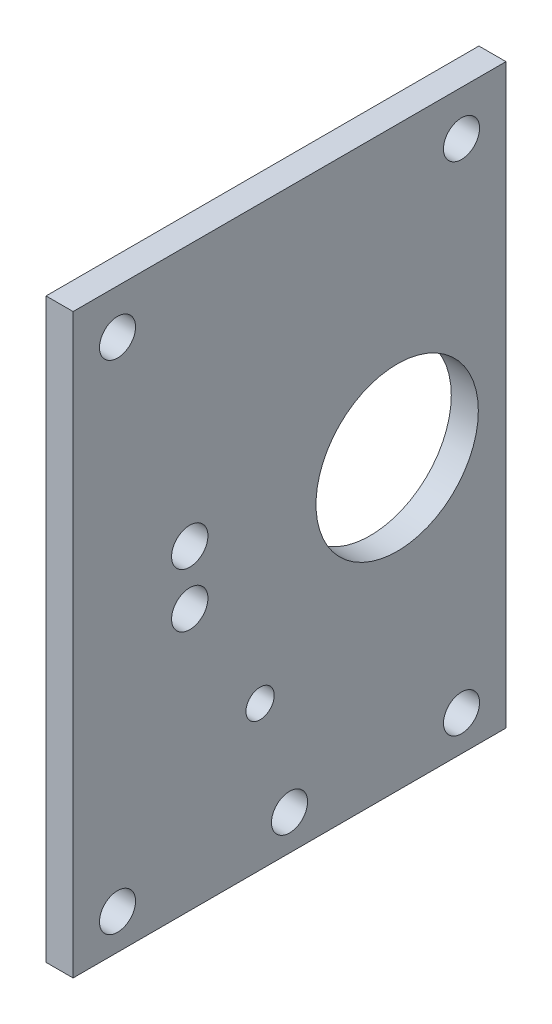
from build123d import *

# Parameters (mm, degrees)
SKETCH2_W            = 76.2
SKETCH2_H            = 101.6
BOSS_EXTRUDE1_DEPTH  = 4.7625
SKETCH3_R            = 3.175
CUT_EXTRUDE1_DEPTH   = 6.35
SKETCH3_4_R          = 3.175
SKETCH3_4_R_2        = 14.2875
SKETCH3_4_R_3        = 2.4892
CUT_EXTRUDE2_DEPTH   = 6.35
M6_CLEARANCE_HOLE1_D = 6.4


with BuildPart() as part:
    # Sketch2 → Boss-Extrude1 (new body)
    with BuildSketch(Plane(origin=(0, 0, 0), x_dir=(0, 0, -1), z_dir=(1, 0, 0))):
        Rectangle(SKETCH2_W, SKETCH2_H)
    extrude(amount=BOSS_EXTRUDE1_DEPTH)

    # Sketch3 → Cut-Extrude1 (cut)
    with BuildSketch(Plane(origin=(4.7625, 0, 0), x_dir=(0, 0, -1), z_dir=(1, 0, 0))):
        with Locations((30.2768, 42.9768)):
            Circle(SKETCH3_R)
    extrude(amount=-CUT_EXTRUDE1_DEPTH, mode=Mode.SUBTRACT)

    # Sketch3<4> → Cut-Extrude2 (cut)
    with BuildSketch(Plane(origin=(4.7625, 0, 0), x_dir=(0, 0, -1), z_dir=(1, 0, 0))):
        with Locations((30.2768, -44.5643)):
            Circle(SKETCH3_4_R)
        with Locations((30.2768, 42.9768)):
            Circle(SKETCH3_4_R)
        with Locations((-30.2768, 42.9768)):
            Circle(SKETCH3_4_R)
        with Locations((-30.2768, -44.5643)):
            Circle(SKETCH3_4_R)
        with Locations((18.9484, 0)):
            Circle(SKETCH3_4_R_2)
        with Locations((-5.1816, -25.4)):
            Circle(SKETCH3_4_R_3)
        with Locations((0, -44.5643)):
            Circle(SKETCH3_4_R)
    extrude(amount=-CUT_EXTRUDE2_DEPTH, mode=Mode.SUBTRACT)

    # M6 Clearance Hole1 (through all)
    with Locations(Plane(origin=(4.7625, 0, 0), x_dir=(0, 0, -1), z_dir=(1, 0, 0))):
        with Locations((-17.5641, 4.7625), (-17.5641, -4.7625)):
            Hole(M6_CLEARANCE_HOLE1_D / 2)


solid = part.part
